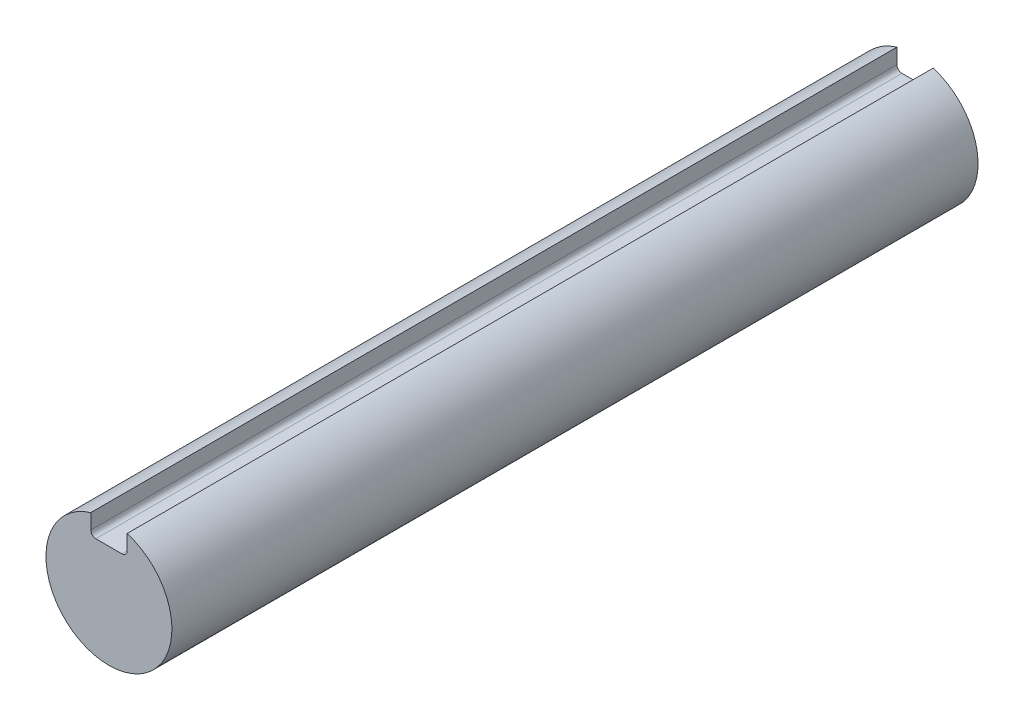
from build123d import *

# Parameters (mm, degrees)
BOSS_EXTRUDE1_DEPTH = 101.6


with BuildPart() as part:
    # Sketch1 → Boss-Extrude1 (new body)
    with BuildSketch(Plane(origin=(0, 0, -302.26), x_dir=(-1, 0, 0), z_dir=(0, 0, -1))):
        with BuildLine():
            Line((2.286, 7.60119137), (2.286, 5.69619137))
            ThreePointArc((2.286, 5.69619137), (2.100012806, 5.247178564), (1.651, 5.06119137))
            Line((1.651, 5.06119137), (-1.651, 5.06119137))
            ThreePointArc((-1.651, 5.06119137), (-2.100012806, 5.247178564), (-2.286, 5.69619137))
            Line((-2.286, 5.69619137), (-2.286, 7.60119137))
            ThreePointArc((-2.286, 7.60119137), (0, -7.9375), (2.286, 7.60119137))
        make_face()
    extrude(amount=-BOSS_EXTRUDE1_DEPTH)


solid = part.part
